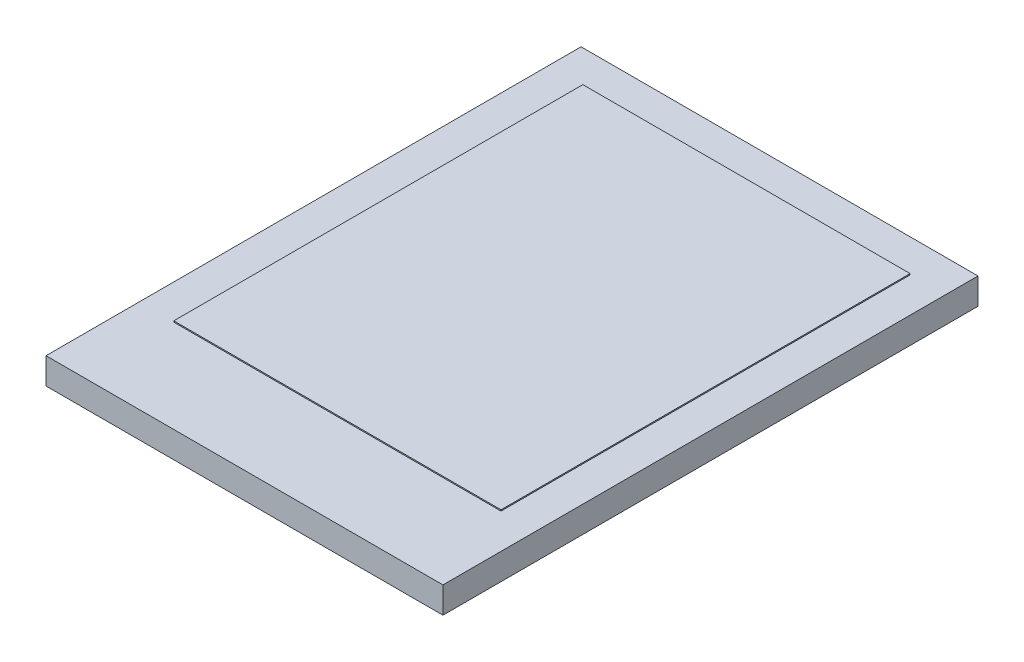
from build123d import *

# Parameters (mm, degrees)
SKETCH_1_W      = 34
SKETCH_1_H      = 45.83
EXTRUDE_1_DEPTH = 2.25
SKETCH_2_W      = 28.03
SKETCH_2_H      = 35.04
EXTRUDE_2_DEPTH = 0.1
SKETCH_4_W      = 0.4
SKETCH_4_H      = 1.8
EXTRUDE_3_DEPTH = 0.1


with BuildPart() as part:
    # Эскиз1 → Бобышка-Вытянуть1 (new body)
    with BuildSketch(Plane(origin=(0, 0, 0), x_dir=(1, 0, 0), z_dir=(0, 1, 0))):
        Rectangle(SKETCH_1_W, SKETCH_1_H)
    extrude(amount=EXTRUDE_1_DEPTH)

    # Эскиз2 → Бобышка-Вытянуть2 (add)
    with BuildSketch(Plane(origin=(0, 2.25, 0), x_dir=(1, 0, 0), z_dir=(0, 1, 0))):
        with Locations((0, 2.565)):
            Rectangle(SKETCH_2_W, SKETCH_2_H)
    extrude(amount=EXTRUDE_2_DEPTH)

    # Эскиз4 → Бобышка-Вытянуть3 (add)
    with BuildSketch(Plane.XZ):
        with Locations((-4.4, 13.564176084)):
            Rectangle(SKETCH_4_W, SKETCH_4_H)
        with Locations((-5.2, 13.564176084)):
            Rectangle(SKETCH_4_W, SKETCH_4_H)
        with Locations((-3.6, 13.564176084)):
            Rectangle(SKETCH_4_W, SKETCH_4_H)
        with Locations((-2.8, 13.564176084)):
            Rectangle(SKETCH_4_W, SKETCH_4_H)
        with Locations((-2, 13.564176084)):
            Rectangle(SKETCH_4_W, SKETCH_4_H)
        with Locations((-1.2, 13.564176084)):
            Rectangle(SKETCH_4_W, SKETCH_4_H)
        with Locations((-0.4, 13.564176084)):
            Rectangle(SKETCH_4_W, SKETCH_4_H)
        with Locations((0.4, 13.564176084)):
            Rectangle(SKETCH_4_W, SKETCH_4_H)
        with Locations((1.2, 13.564176084)):
            Rectangle(SKETCH_4_W, SKETCH_4_H)
        with Locations((2, 13.564176084)):
            Rectangle(SKETCH_4_W, SKETCH_4_H)
        with Locations((2.8, 13.564176084)):
            Rectangle(SKETCH_4_W, SKETCH_4_H)
        with Locations((3.6, 13.564176084)):
            Rectangle(SKETCH_4_W, SKETCH_4_H)
        with Locations((4.4, 13.564176084)):
            Rectangle(SKETCH_4_W, SKETCH_4_H)
        with Locations((5.2, 13.564176084)):
            Rectangle(SKETCH_4_W, SKETCH_4_H)
    extrude(amount=EXTRUDE_3_DEPTH)


solid = part.part
